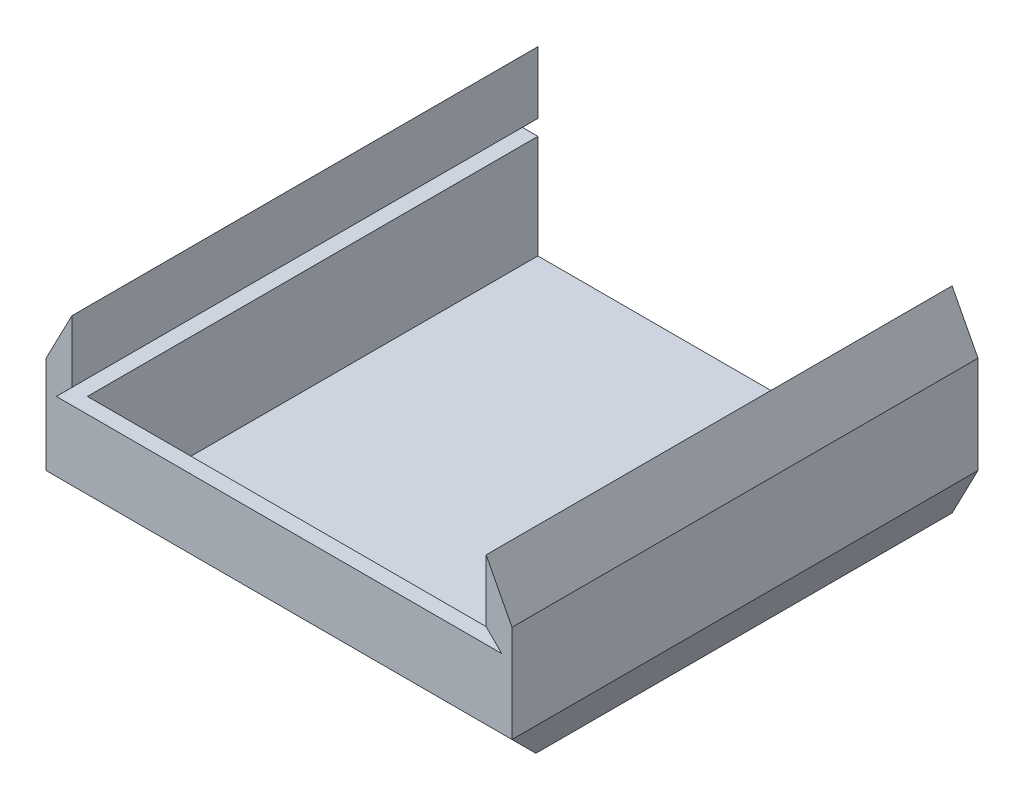
from build123d import *

# Parameters (mm, degrees)
SKETCH1_W                           = 80
SKETCH1_H                           = 90
BOSS_EXTRUDE1_BASE_DEPTH            = 3
BOSS_EXTRUDE4_SIDE_WALLS_DEPTH      = 90
CUT_EXTRUDE2_GUIDE_HOLES_DEPTH      = 130.495173655
SKETCH15_W                          = 80
SKETCH15_H                          = 20
BOSS_EXTRUDE9_FRONT_WALL_DEPTH      = 3
CHAMFER5_FRONT_CHAMFER_SIZE         = 9.61
CHAMFER6_FRONT_CHAMFER_CLEANUP_SIZE = 5


with BuildPart() as part:
    # Sketch1 → Boss-Extrude1 (Base) (new body)
    with BuildSketch(Plane(origin=(0, 0, 0), x_dir=(1, 0, 0), z_dir=(0, 1, 0))):
        with Locations((40, 45)):
            Rectangle(SKETCH1_W, SKETCH1_H)
    extrude(amount=BOSS_EXTRUDE1_BASE_DEPTH)

    # Sketch5 → Boss-Extrude4 (Side Walls) (add, through all)
    with BuildSketch(Plane.XY):
        Polygon((-5, 28.390936655), (0, 38), (0, 0), (-5, 9.609063345), align=None)
        Polygon((85, 9.609063345), (85, 28.390936655), (80, 38), (80, 0), align=None)
    extrude(amount=-BOSS_EXTRUDE4_SIDE_WALLS_DEPTH)

    # Sketch4 → Cut-Extrude2 (Guide Holes) (cut, through all)
    with BuildSketch(Plane.XY):
        Polygon((-3, 23), (0, 26), (0, 23), align=None)
        Polygon((80, 23), (83, 23), (80, 26), align=None)
    extrude(amount=-CUT_EXTRUDE2_GUIDE_HOLES_DEPTH, mode=Mode.SUBTRACT)

    # Sketch15 → Boss-Extrude9 (Front Wall) (add)
    with BuildSketch(Plane.XY):
        with Locations((40, 13)):
            Rectangle(SKETCH15_W, SKETCH15_H)
    extrude(amount=-BOSS_EXTRUDE9_FRONT_WALL_DEPTH)

    # Chamfer5 (Front Chamfer)
    chamfer5_front_chamfer_edges = [part.edges().sort_by_distance(p)[0] for p in [
        (40, 0, 0),
    ]]
    chamfer(chamfer5_front_chamfer_edges, length=CHAMFER5_FRONT_CHAMFER_SIZE)

    # Chamfer6 (Front Chamfer Cleanup)
    chamfer6_front_chamfer_cleanup_edges = [part.edges().sort_by_distance(p)[0] for p in [
        (40, 3, -3),
    ]]
    chamfer(chamfer6_front_chamfer_cleanup_edges, length=CHAMFER6_FRONT_CHAMFER_CLEANUP_SIZE)


solid = part.part
